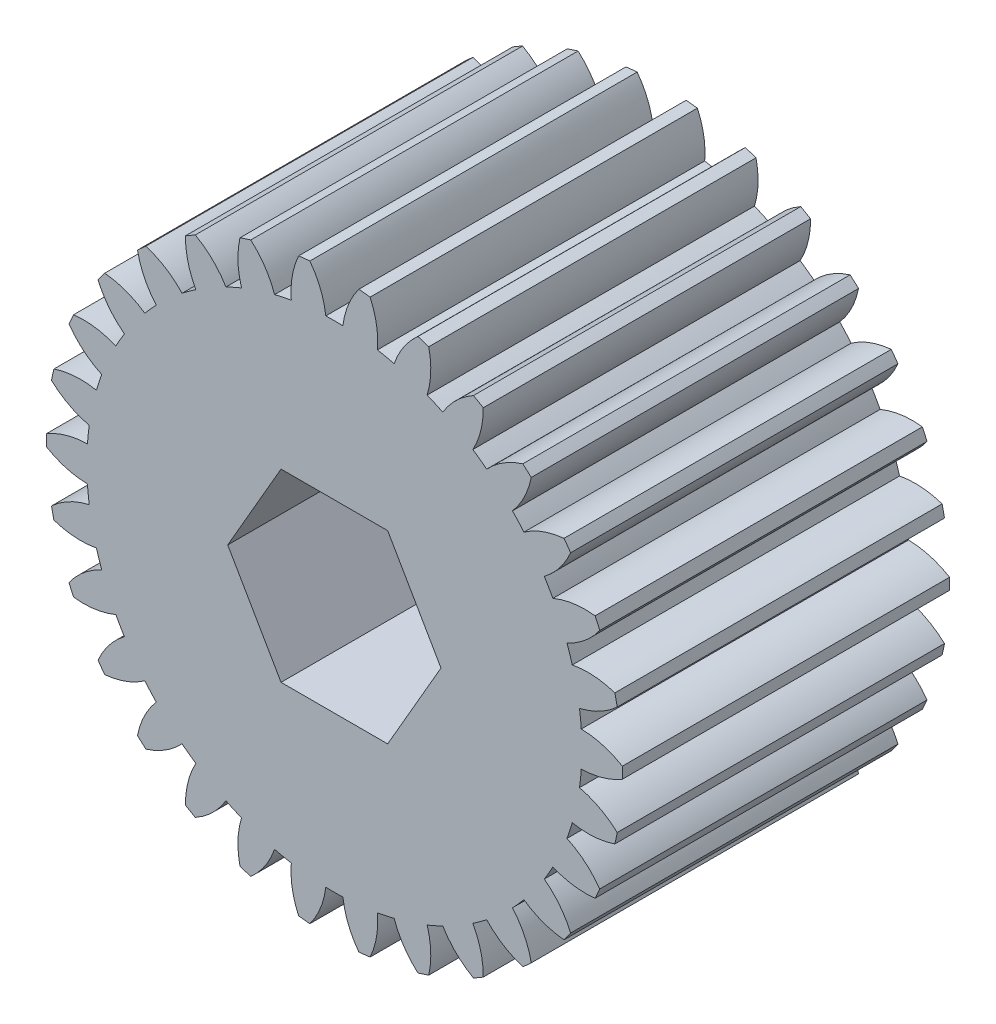
from build123d import *

# Parameters (mm, degrees)
SKETCH_1_R               = 12.32
EXTRUDE_1_DEPTH          = 7
PATTERN_CIRCULAR_1_COUNT = 30
CUT_EXTRUDE_1_DEPTH      = 23.326435382


with BuildPart() as part:
    # Эскиз1 → Бобышка-Вытянуть1 (new, symmetric)
    with BuildSketch(Plane.XY):
        Circle(SKETCH_1_R)
    extrude(amount=EXTRUDE_1_DEPTH, both=True)

    # Эскиз5 for Вырез-По сечениям1 → Вырез-По сечениям1 section 0
    with BuildSketch(Plane.XY.offset(-7)):
        with BuildLine():
            # circular arc as an exact rational Bezier (weights 1, cos(half-angle), 1)
            Bezier((-1.458691761, 12.736742847), (-0.522105639, 11.856767026), (-0.365824723, 10.581178031), weights=[1, 0.940287899, 1])
            Bezier((-0.365824723, 10.581178031), (0, 10.593825746), (0.365824723, 10.581178031), weights=[1, 0.999402884, 1])
            Bezier((0.365824723, 10.581178031), (0.522105639, 11.856767026), (1.458691761, 12.736742847), weights=[1, 0.940287899, 1])
            Bezier((1.458691761, 12.736742847), (0, 12.903801386), (-1.458691761, 12.736742847), weights=[1, 0.993505682, 1])
        make_face()
    # Эскиз2 for Вырез-По сечениям1 → Вырез-По сечениям1 section 1
    with BuildSketch(Plane.XY.offset(7)):
        with BuildLine():
            Bezier((-1.458691761, 12.736742847), (-0.522105639, 11.856767026), (-0.365824723, 10.581178031), weights=[1, 0.940287899, 1])
            Bezier((-0.365824723, 10.581178031), (0, 10.593825746), (0.365824723, 10.581178031), weights=[1, 0.999402884, 1])
            Bezier((0.365824723, 10.581178031), (0.522105639, 11.856767026), (1.458691761, 12.736742847), weights=[1, 0.940287899, 1])
            Bezier((1.458691761, 12.736742847), (0, 12.903801386), (-1.458691761, 12.736742847), weights=[1, 0.993505682, 1])
        make_face()
    loft_1 = loft(mode=Mode.SUBTRACT)

    # Круговой массив1: Вырез-По сечениям1 ×30 about axis
    pattern_circular_1_axis = Axis((0, 0, 0), (0, 0, 1))
    for i in range(1, PATTERN_CIRCULAR_1_COUNT):
        add(loft_1.rotate(pattern_circular_1_axis, i * 360 / PATTERN_CIRCULAR_1_COUNT), mode=Mode.SUBTRACT)

    # Эскиз6 → Вырез-Вытянуть1 (cut, through all)
    with BuildSketch(Plane.XY.offset(7)):
        Polygon((-2.280533563, 3.95), (-4.561067127, 0), (-2.280533563, -3.95), (2.280533563, -3.95), (4.561067127, 0), (2.280533563, 3.95), align=None)
    extrude(amount=-CUT_EXTRUDE_1_DEPTH, mode=Mode.SUBTRACT)


solid = part.part
